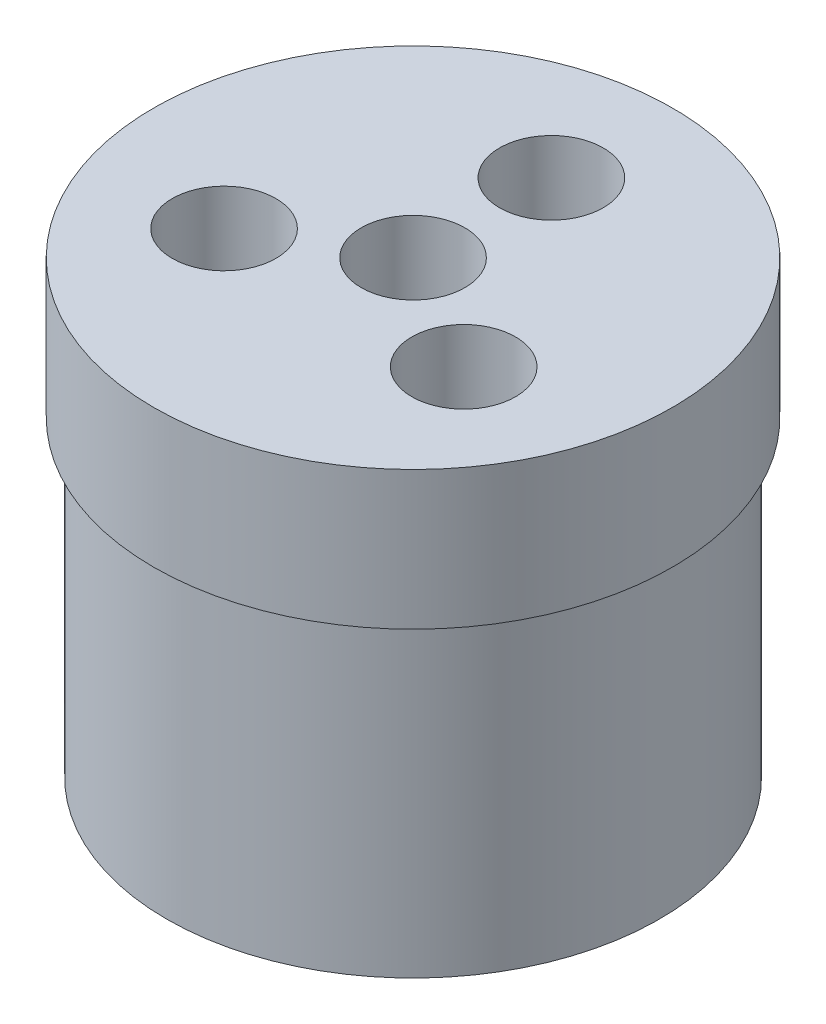
from build123d import *

# Parameters (mm, degrees)
SKETCH_1_R          = 15
EXTRUDE_1_DEPTH     = 8
SKETCH_1_3_R        = 14.25
EXTRUDE_2_DEPTH     = 18
SKETCH_2_R          = 3
CUT_EXTRUDE_1_DEPTH = 34.555923471


with BuildPart() as part:
    # 스케치1 → 보스-돌출1 (new body)
    with BuildSketch(Plane(origin=(0, 0, 0), x_dir=(1, 0, 0), z_dir=(0, 1, 0))):
        Circle(SKETCH_1_R)
    extrude(amount=EXTRUDE_1_DEPTH)

    # 스케치1<3> → 보스-돌출2 (add)
    with BuildSketch(Plane(origin=(0, 0, 0), x_dir=(1, 0, 0), z_dir=(0, 1, 0))):
        Circle(SKETCH_1_3_R)
    extrude(amount=-EXTRUDE_2_DEPTH)

    # 스케치2 → 컷-돌출1 (cut, through all)
    with BuildSketch(Plane(origin=(0, 8, 0), x_dir=(1, 0, 0), z_dir=(0, 1, 0))):
        with Locations((0, 8)):
            Circle(SKETCH_2_R)
        Circle(SKETCH_2_R)
        with Locations((6.92820323, -4)):
            Circle(SKETCH_2_R)
        with Locations((-6.92820323, -4)):
            Circle(SKETCH_2_R)
    extrude(amount=-CUT_EXTRUDE_1_DEPTH, mode=Mode.SUBTRACT)


solid = part.part
